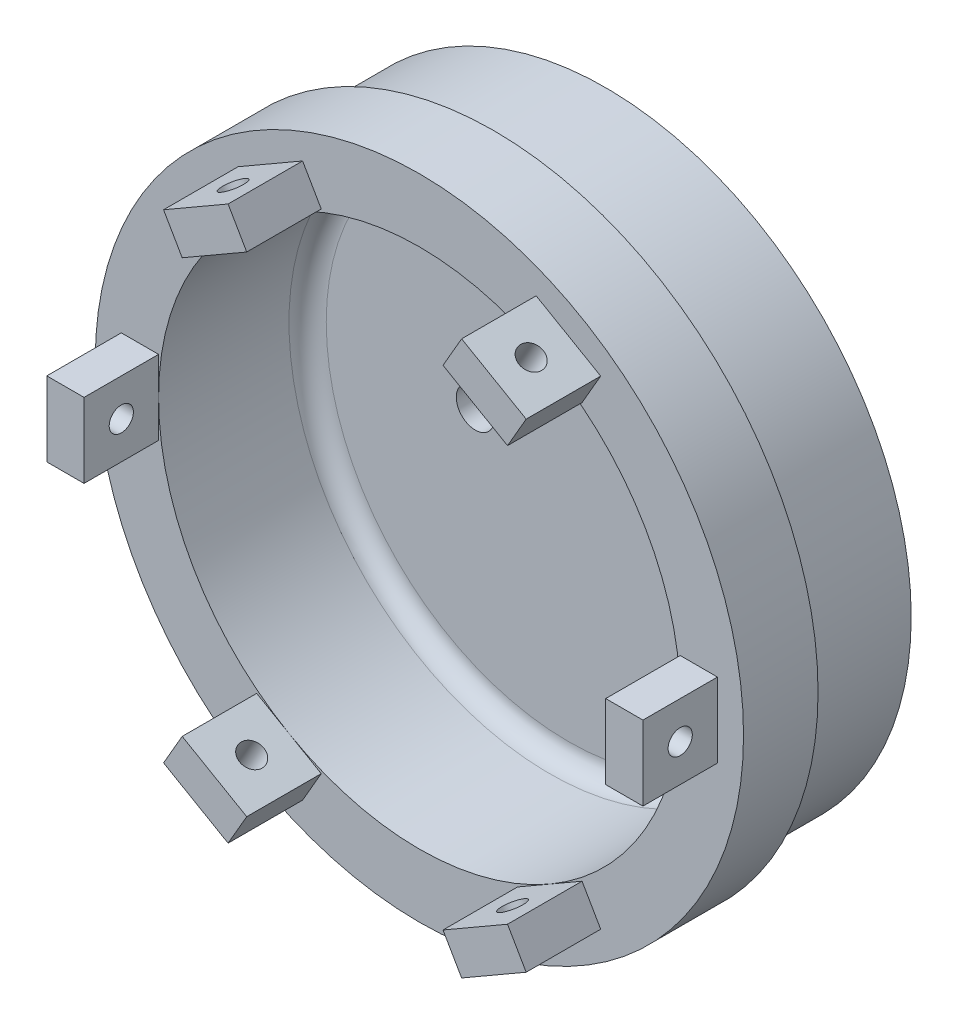
from build123d import *

# Parameters (mm, degrees)
CUT_EXTRUDE1_REACH  = 134.808
SKETCH3_R           = 5.1
BOSS_EXTRUDE3_DEPTH = 20
CUT_EXTRUDE2_REACH  = 202.893
SKETCH6_R           = 3.25
CIRPATTERN1_COUNT   = 6


with BuildPart() as part:
    # Sketch1 → Revolve1 (revolve)
    with BuildSketch(Plane(origin=(0, 0, 0), x_dir=(1, 0, 0), z_dir=(0, 1, 0))):
        with BuildLine():
            Line((0, 0), (82, 0))
            Line((82, 0), (82, -30))
            Line((82, -30), (87, -30))
            Line((87, -30), (87, -50))
            Line((87, -50), (70, -50))
            Line((70, -50), (70, -15))
            ThreePointArc((70, -15), (68.535533906, -11.464466094), (65, -10))
            Line((65, -10), (0, -10))
            Line((0, -10), (0, 0))
        make_face()
    revolve(axis=Axis((0, 0, 0), (0, 0, -1)))

    # Sketch3 → Cut-Extrude1 (cut, up to next)
    with BuildSketch(Plane(origin=(0, 0, 0), x_dir=(-1, 0, 0), z_dir=(0, 0, -1)), mode=Mode.PRIVATE) as cut_extrude1_sk1:
        with Locations((-25, 0)):
            Circle(SKETCH3_R)
    cut_extrude1_tool1 = extrude(cut_extrude1_sk1.sketch, amount=-CUT_EXTRUDE1_REACH, mode=Mode.PRIVATE) & part.part
    # Sketch3 → Cut-Extrude1 (cut, up to next)
    with BuildSketch(Plane(origin=(0, 0, 0), x_dir=(-1, 0, 0), z_dir=(0, 0, -1)), mode=Mode.PRIVATE) as cut_extrude1_sk2:
        with Locations((25, 0)):
            Circle(SKETCH3_R)
    cut_extrude1_tool2 = extrude(cut_extrude1_sk2.sketch, amount=-CUT_EXTRUDE1_REACH, mode=Mode.PRIVATE) & part.part
    # Sketch3 → Cut-Extrude1 (cut, up to next)
    with BuildSketch(Plane(origin=(0, 0, 0), x_dir=(-1, 0, 0), z_dir=(0, 0, -1)), mode=Mode.PRIVATE) as cut_extrude1_sk3:
        with BuildLine():
            ThreePointArc((10.592538838, 60.073272934), (15.22636256, 63.317911235), (11.981724259, 67.951734958))
            ThreePointArc((11.981724259, 67.951734958), (0, 69), (-11.981724259, 67.951734958))
            ThreePointArc((-11.981724259, 67.951734958), (-15.22636256, 63.317911235), (-10.592538838, 60.073272934))
            ThreePointArc((-10.592538838, 60.073272934), (0, 61), (10.592538838, 60.073272934))
        make_face()
    cut_extrude1_tool3 = extrude(cut_extrude1_sk3.sketch, amount=-CUT_EXTRUDE1_REACH, mode=Mode.PRIVATE) & part.part
    add(cut_extrude1_tool1.solids().sort_by_distance((25, 0, 0))[0], mode=Mode.SUBTRACT)
    add(cut_extrude1_tool2.solids().sort_by_distance((-25, 0, 0))[0], mode=Mode.SUBTRACT)
    add(cut_extrude1_tool3.solids().sort_by_distance((0, 64.527802, 0))[0], mode=Mode.SUBTRACT)

    # Sketch5 → Boss-Extrude3 (add)
    with BuildSketch(Plane.XY.offset(50)):
        Polygon((80, 10), (80, 0), (80, -10), (70, -10), (70, 10), align=None)
    boss_extrude3 = extrude(amount=BOSS_EXTRUDE3_DEPTH)

    # Sketch6 → Cut-Extrude2 (cut, up to next)
    with BuildSketch(Plane(origin=(80, 0, 0), x_dir=(0, 1, 0), z_dir=(-1, 0, 0)), mode=Mode.PRIVATE) as cut_extrude2_sk1:
        with Locations(Location((0, -60, 0), (0, 0, 90))):
            Circle(SKETCH6_R)
    cut_extrude2_tool1 = extrude(cut_extrude2_sk1.sketch, amount=CUT_EXTRUDE2_REACH, mode=Mode.PRIVATE) & part.part
    cut_extrude2 = cut_extrude2_tool1.solids().sort_by_distance((80, 0, 60))[0]
    add(cut_extrude2, mode=Mode.SUBTRACT)

    # CirPattern1: Boss-Extrude3, Cut-Extrude2 ×6 about axis
    cirpattern1_axis = Axis((0, 0, 0), (0, 0, 1))
    add([boss_extrude3.rotate(cirpattern1_axis, i * 360 / CIRPATTERN1_COUNT) for i in range(1, CIRPATTERN1_COUNT)])
    add([cut_extrude2.rotate(cirpattern1_axis, i * 360 / CIRPATTERN1_COUNT) for i in range(1, CIRPATTERN1_COUNT)], mode=Mode.SUBTRACT)


solid = part.part
